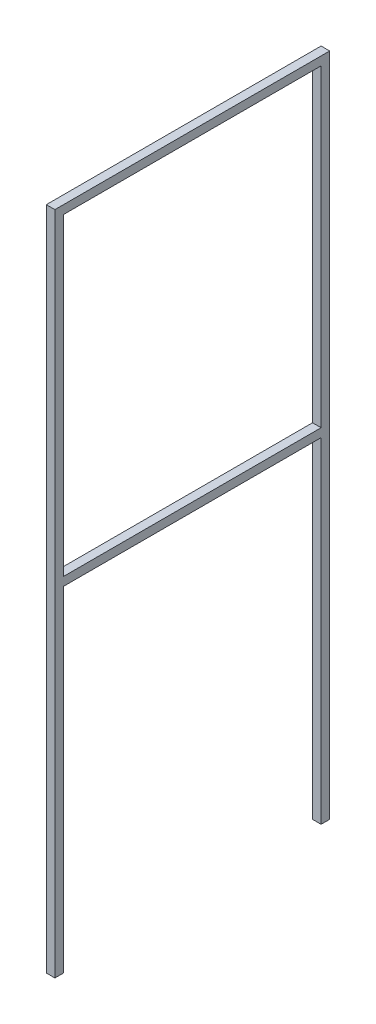
from build123d import *

# Parameters (mm, degrees)
BOSS_EXTRUDE1_DEPTH = 20


with BuildPart() as part:
    # Sketch1 → Boss-Extrude1 (new body)
    with BuildSketch(Plane(origin=(0, 0, 0), x_dir=(0, 0, -1), z_dir=(1, 0, 0))):
        Polygon((-600, -650), (-600, -520), (0, -520), (0, -650), (0, -670), (0, -1300), (20, -1300), (20, -500), (20, 0), (20, 250), (0, 250), (-600, 250), (-620, 250), (-620, 0), (-620, -500), (-620, -1300), (-600, -1300), (-600, -670), align=None)
        Polygon((0, 230), (0, 0), (0, -500), (-600, -500), (-600, 0), (-600, 230), align=None, mode=Mode.SUBTRACT)
    extrude(amount=BOSS_EXTRUDE1_DEPTH)


solid = part.part
